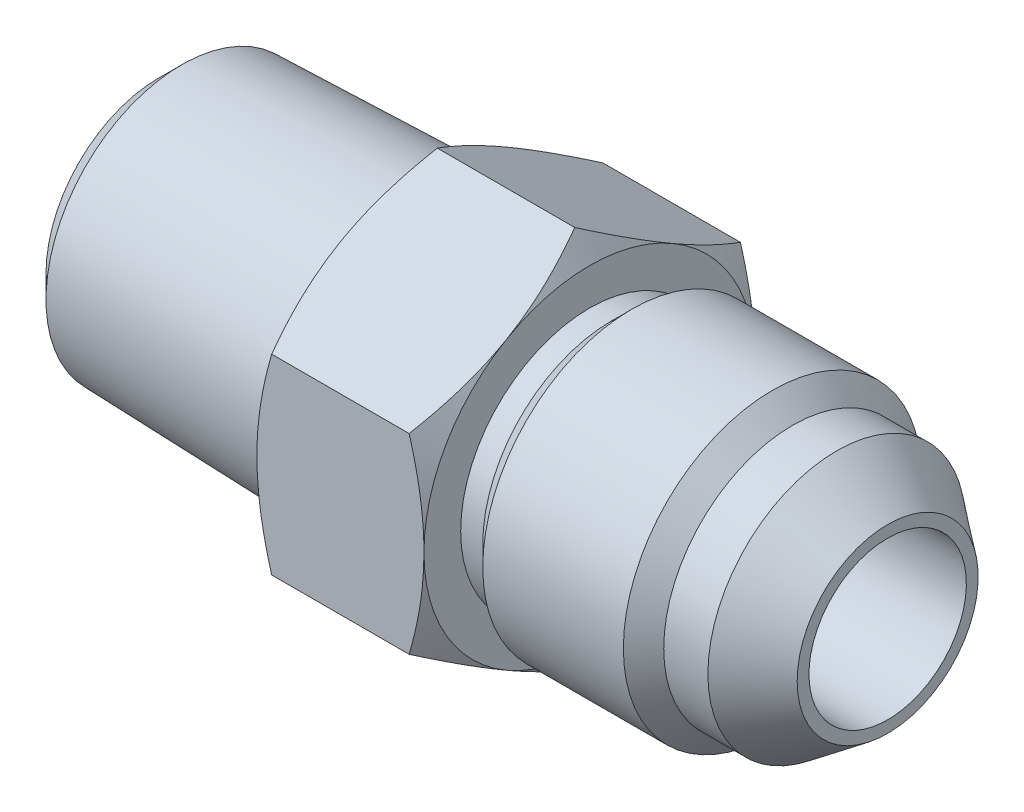
from build123d import *

# Parameters (mm, degrees)
SKETCH6_W           = 34.925
SKETCH6_H           = 7.14375
EXTRUDE1_DEPTH      = 8.00608
SKETCH7_W           = 34.925
SKETCH7_H           = 3.7719
SKETCH17_R          = 7.14375
CUT_EXTRUDE1_DEPTH  = 12.63142
SKETCH19_R          = 6.858
BOSS_EXTRUDE1_DEPTH = 12.63142
BOSS_EXTRUDE1_DRAFT = -1.75
CHAMFER1_SIZE       = 1.058333333
CHAMFER1_SIZE2      = 1.092196811
SKETCH22_R          = 6.858
BOSS_EXTRUDE3_DEPTH = 12.63142
BOSS_EXTRUDE3_DRAFT = -15
SKETCH23_R          = 4.651741881
CUT_EXTRUDE2_DEPTH  = 12.63142


with BuildPart() as part:
    # Sketch6 → Revolve3 (revolve)
    with BuildSketch(Plane.XY, mode=Mode.PRIVATE) as revolve3_sk:
        with Locations((0, 3.571875)):
            Rectangle(SKETCH6_W, SKETCH6_H)
    revolve(revolve3_sk.sketch.rotate(Axis((-17.4625, 0, 0), (1, 0, 0)), 90), axis=Axis((-17.4625, 0, 0), (1, 0, 0)))

    # Sketch12 → Extrude1 (add)
    with BuildSketch(Plane(origin=(-4.83108, 0, 0), x_dir=(0, 0, -1), z_dir=(1, 0, 0))):
        Polygon((0, 9.165435523), (-7.9375, 4.582717762), (-7.9375, -4.582717762), (0, -9.165435523), (7.9375, -4.582717762), (7.9375, 4.582717762), align=None)
    extrude(amount=EXTRUDE1_DEPTH)

    # Sketch10 → Cut-Revolve6 (revolve, cut)
    with BuildSketch(Plane.XY, mode=Mode.PRIVATE) as cut_revolve6_sk:
        Polygon((5.200676886, 7.14375), (3.175, 7.14375), (3.175, 6.176406448), (4.233333333, 6.176406448), align=None)
        Polygon((17.4625, 7.14375), (11.938424005, 7.14375), (12.905767558, 6.176406448), (15.022434224, 6.176406448), (17.4625, 4.337685), align=None)
    revolve(cut_revolve6_sk.sketch.rotate(Axis((-17.4625, 0, 0), (1, 0, 0)), 90), axis=Axis((-17.4625, 0, 0), (1, 0, 0)), mode=Mode.SUBTRACT)

    # Sketch7 → Cut-Revolve5 (revolve, cut)
    with BuildSketch(Plane.XY):
        with Locations((0, 1.88595)):
            Rectangle(SKETCH7_W, SKETCH7_H)
    revolve(axis=Axis((17.4625, 0, 0), (-1, 0, 0)), mode=Mode.SUBTRACT)

    # Sketch13 → Cut-Revolve7 (revolve, cut)
    with BuildSketch(Plane.XY):
        Polygon((-4.83108, 9.165435523), (-4.83108, 7.9375), (-4.122131095, 9.165435523), align=None)
        Polygon((2.466051095, 9.165435523), (3.175, 7.9375), (3.175, 9.165435523), align=None)
    revolve(axis=Axis((-17.4625, 0, 0), (1, 0, 0)), mode=Mode.SUBTRACT)

    # Sketch17 → Cut-Extrude1 (cut)
    with BuildSketch(Plane.ZY.offset(17.4625)):
        Circle(SKETCH17_R)
    extrude(amount=-CUT_EXTRUDE1_DEPTH, mode=Mode.SUBTRACT)


with BuildPart() as body_2:
    # Sketch19 → Boss-Extrude1 (with draft: the straight prism first)
    with BuildSketch(Plane(origin=(-4.83108, 0, 0), x_dir=(0, 0, -1), z_dir=(1, 0, 0))):
        Circle(SKETCH19_R)
    extrude(amount=-BOSS_EXTRUDE1_DEPTH)
    # Boss-Extrude1: the draft: its side faces are tilted about the plane it starts from
    boss_extrude1_sides = [body_2.faces().sort_by_distance(p)[0] for p in [
        (-11.14679, 0, 6.858),
    ]]
    draft(boss_extrude1_sides, Plane(origin=(-4.83108, 0, 0), x_dir=(0, 0, -1), z_dir=(1, 0, 0)), BOSS_EXTRUDE1_DRAFT)

    # Chamfer1
    chamfer1_edges = [body_2.edges().sort_by_distance(p)[0] for p in [
        (-17.4625, 0, 6.472075215),
    ]]
    chamfer1_side = [body_2.faces().sort_by_distance(p)[0] for p in [
        (-17.4625, 0, 0),
    ]]
    chamfer(chamfer1_edges, length=CHAMFER1_SIZE, length2=CHAMFER1_SIZE2, reference=chamfer1_side[0])


with BuildPart() as boss_extrude3_tool:
    # Sketch22 → Boss-Extrude3 (with draft: the straight prism first)
    with BuildSketch(Plane(origin=(-4.83108, 0, 0), x_dir=(0, 0, -1), z_dir=(1, 0, 0))):
        Circle(SKETCH22_R)
    extrude(amount=-BOSS_EXTRUDE3_DEPTH)
    # Boss-Extrude3: the draft: its side faces are tilted about the plane it starts from
    boss_extrude3_sides = [boss_extrude3_tool.faces().sort_by_distance(p)[0] for p in [
        (-11.14679, 0, 6.858),
    ]]
    draft(boss_extrude3_sides, Plane(origin=(-4.83108, 0, 0), x_dir=(0, 0, -1), z_dir=(1, 0, 0)), BOSS_EXTRUDE3_DRAFT)


with BuildPart() as body_2_1:
    add(body_2.part)

    # Boss-Extrude3: add boss_extrude3_tool
    add(boss_extrude3_tool.part)

    # Combine1: union part
    add(part.part)

    # Sketch23 → Cut-Extrude2 (cut)
    with BuildSketch(Plane.ZY.offset(17.4625)):
        Circle(SKETCH23_R)
    extrude(amount=-CUT_EXTRUDE2_DEPTH, mode=Mode.SUBTRACT)


solid = body_2_1.part
